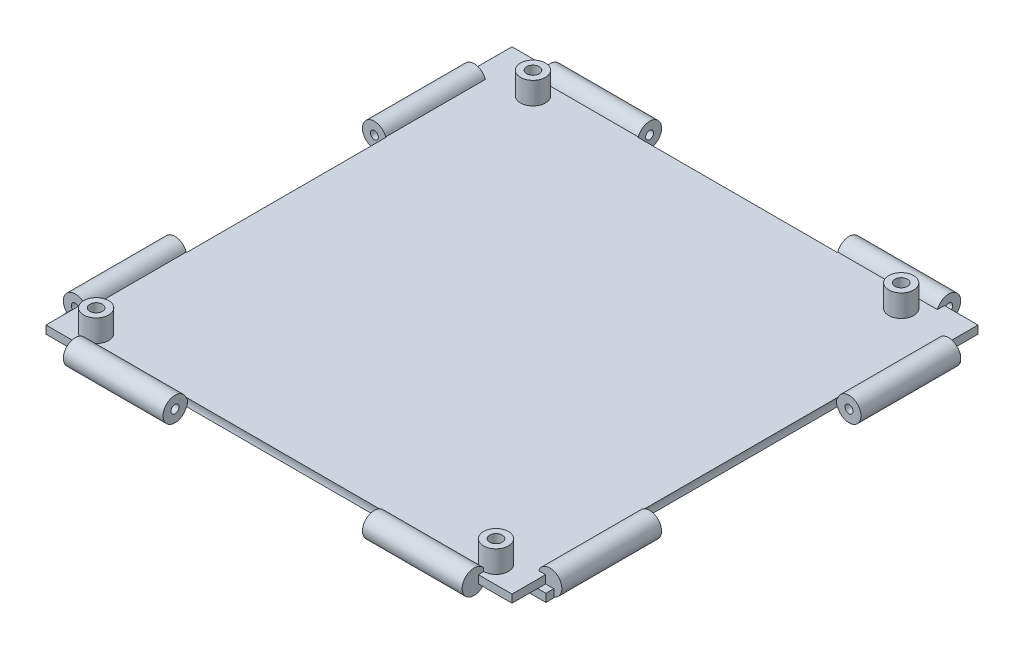
from build123d import *

# Parameters (mm, degrees)
SKETCH3_W                 = 97
SKETCH3_H                 = 97
BOSS_EXTRUDE2_DEPTH       = 1.6
SKETCH6_R                 = 2.4
BOSS_EXTRUDE3_DEPTH       = 25
SKETCH8_R                 = 2.4
BOSS_EXTRUDE4_DEPTH       = 25
BOSS_EXTRUDE5_START       = -25
SKETCH10_R                = 2.4
BOSS_EXTRUDE5_DEPTH       = 25
BOSS_EXTRUDE6_START       = -25
SKETCH11_R                = 2.4
BOSS_EXTRUDE6_DEPTH       = 25
SKETCH12_R                = 2.4
BOSS_EXTRUDE7_DEPTH       = 25
SKETCH13_R                = 2.4
BOSS_EXTRUDE8_DEPTH       = 25
BOSS_EXTRUDE9_START       = -25
SKETCH15_R                = 2.4
BOSS_EXTRUDE9_DEPTH       = 25
BOSS_EXTRUDE10_START      = -25
SKETCH16_R                = 2.4
BOSS_EXTRUDE10_DEPTH      = 25
SKETCH24_W                = 4.8
SKETCH24_H                = 5.548100674
CUT_EXTRUDE6_DEPTH        = 3.3
SKETCH25_W                = 4.8
SKETCH25_H                = 4.8
CUT_EXTRUDE7_DEPTH        = 3.3
SKETCH27_W                = 4.8
SKETCH27_H                = 5.15761508
CUT_EXTRUDE8_DEPTH        = 3.3
SKETCH28_W                = 4.8
SKETCH28_H                = 4.8
CUT_EXTRUDE9_DEPTH        = 6
SKETCH29_W                = 4.8
SKETCH29_H                = 5.426654508
CUT_EXTRUDE10_DEPTH       = 3.3
SKETCH30_W                = 5.09884484
SKETCH30_H                = 4.8
CUT_EXTRUDE11_DEPTH       = 3.3
SKETCH31_W                = 4.8
SKETCH31_H                = 5.480877926
CUT_EXTRUDE12_DEPTH       = 3.3
SKETCH32_W                = 4.987524697
SKETCH32_H                = 4.8
CUT_EXTRUDE13_DEPTH       = 3.3
BOSS_EXTRUDE11_START      = 1
SKETCH38_R                = 2.4
BOSS_EXTRUDE11_DEPTH      = 1
SKETCH39_R                = 2.4
BOSS_EXTRUDE12_DEPTH      = 1
BOSS_EXTRUDE13_START      = 1
SKETCH42_R                = 2.4
BOSS_EXTRUDE13_DEPTH      = 1
SKETCH43_R                = 2.4
BOSS_EXTRUDE14_DEPTH      = 1
BOSS_EXTRUDE15_START      = 1
SKETCH44_R                = 2.4
BOSS_EXTRUDE15_DEPTH      = 1
SKETCH45_R                = 2.4
BOSS_EXTRUDE16_DEPTH      = 1
BOSS_EXTRUDE17_START      = 1
SKETCH46_R                = 2.4
BOSS_EXTRUDE17_DEPTH      = 1
SKETCH47_R                = 2.4
BOSS_EXTRUDE18_DEPTH      = 1
CUT_EXTRUDE24_DEPTH       = 5.2
CUT_EXTRUDE25_DEPTH       = 5.2
CUT_EXTRUDE26_DEPTH       = 5.2
CUT_EXTRUDE27_DEPTH       = 5.2
CUT_EXTRUDE29_DEPTH       = 5.2
CUT_EXTRUDE30_DEPTH       = 5.2
CUT_EXTRUDE31_DEPTH       = 5.2
CUT_EXTRUDE32_DEPTH       = 5.2
SKETCH81_W                = 1.5372583
SKETCH81_H                = 1.5372583
BOSS_EXTRUDE21_DEPTH      = 1.6
SKETCH82_W                = 1.5372583
SKETCH82_H                = 1.5372583
BOSS_EXTRUDE22_DEPTH      = 1.6
SKETCH83_W                = 1.5372583
SKETCH83_H                = 1.5372583
BOSS_EXTRUDE23_DEPTH      = 1.6
SKETCH84_W                = 1.5372583
SKETCH84_H                = 1.5372583
BOSS_EXTRUDE24_DEPTH      = 1.6
SKETCH87_R                = 2.4
BOSS_EXTRUDE25_DEPTH      = 2.5
BOSS_EXTRUDE26_START      = 2.5
SKETCH88_R                = 2.4
BOSS_EXTRUDE26_DEPTH      = 2.5
SKETCH91_R                = 2.5
CUT_EXTRUDE33_DEPTH       = 40
BOSS_EXTRUDE27_START      = 2.5
SKETCH93_R                = 2.4
BOSS_EXTRUDE27_DEPTH      = 2.5
SKETCH94_R                = 2.4
BOSS_EXTRUDE28_DEPTH      = 2.5
SKETCH97_R                = 2.5
CUT_EXTRUDE34_DEPTH       = 40
BOSS_EXTRUDE29_START      = 2.5
SKETCH98_R                = 2.4
BOSS_EXTRUDE29_DEPTH      = 2.5
SKETCH99_R                = 2.4
BOSS_EXTRUDE30_DEPTH      = 2.5
SKETCH100_R               = 2.5
CUT_EXTRUDE35_DEPTH       = 40
SKETCH101_R               = 2.4
BOSS_EXTRUDE31_DEPTH      = 2.5
BOSS_EXTRUDE32_START      = 2.5
SKETCH102_R               = 2.4
BOSS_EXTRUDE32_DEPTH      = 2.5
SKETCH104_R               = 2.5
CUT_EXTRUDE36_DEPTH       = 40
SKETCH105_R               = 0.81
CUT_EXTRUDE37_DEPTH       = 78.5
SKETCH106_R               = 0.81
CUT_EXTRUDE38_DEPTH       = 78.5
SKETCH107_R               = 0.81
CUT_EXTRUDE39_DEPTH       = 78.5
SKETCH108_R               = 0.81
CUT_EXTRUDE40_DEPTH       = 78.5
CUT_EXTRUDE47_DEPTH       = 20
CUT_EXTRUDE48_DEPTH       = 20
CUT_EXTRUDE49_DEPTH       = 20
CUT_EXTRUDE50_DEPTH       = 20
SKETCH139_R               = 15
BOSS_EXTRUDE40_DEPTH      = 1.6
SKETCH140_R               = 5
CUT_EXTRUDE51_DEPTH       = 1.6
FILLET7_R                 = 2
CUT_EXTRUDE41_DEPTH       = 1.6
CUT_EXTRUDE42_DEPTH       = 1.6
CUT_EXTRUDE43_DEPTH       = 1.6
CUT_EXTRUDE44_DEPTH       = 1.6
SKETCH123_R               = 15
BOSS_EXTRUDE35_DEPTH      = 1.6
SKETCH124_R               = 5
CUT_EXTRUDE45_DEPTH       = 1.6
FILLET4_R                 = 2
SKETCH144_W               = 6.7372583
SKETCH144_H               = 1.6
BOSS_EXTRUDE42_DEPTH      = 1.6
SKETCH145_W               = 8.3372583
SKETCH145_H               = 1.6
BOSS_EXTRUDE43_DEPTH      = 1.6
SKETCH147_W               = 8.4
SKETCH147_H               = 1.6
BOSS_EXTRUDE44_DEPTH      = 1.6
SKETCH149_W               = 8.4
SKETCH149_H               = 1.6
BOSS_EXTRUDE45_DEPTH      = 1.6
SKETCH150_W               = 8.4
SKETCH150_H               = 1.6
BOSS_EXTRUDE46_DEPTH      = 1.6
SKETCH151_W               = 8.4
SKETCH151_H               = 1.6
BOSS_EXTRUDE47_DEPTH      = 1.6
FILLET12_R                = 1
SKETCH162_R               = 2.5
BOSS_EXTRUDE53_DEPTH      = 4.45
SKETCH163_R               = 2.5
BOSS_EXTRUDE54_DEPTH      = 4.45
SKETCH164_R               = 2.5
BOSS_EXTRUDE55_DEPTH      = 4.45
SKETCH172_R               = 2.5
BOSS_EXTRUDE57_DEPTH      = 4.45
M3X0_5_TAPPED_HOLE2_D     = 2.5
M3X0_5_TAPPED_HOLE2_DEPTH = 4.45
M3X0_5_TAPPED_HOLE2_TIP   = 0.751075774
SKETCH176_W               = 84.989213742
SKETCH176_H               = 89.710836726
BOSS_EXTRUDE58_DEPTH      = 1.6


with BuildPart() as part:
    # Sketch3 → Boss-Extrude2 (new body)
    with BuildSketch(Plane(origin=(0, 0, 0), x_dir=(1, 0, 0), z_dir=(0, 1, 0))):
        Rectangle(SKETCH3_W, SKETCH3_H)
    extrude(amount=BOSS_EXTRUDE2_DEPTH)

    # Sketch6 → Boss-Extrude3 (add)
    with BuildSketch(Plane.XY.offset(48.5)):
        with Locations((-47.6, 0.8)):
            Circle(SKETCH6_R)
    extrude(amount=-BOSS_EXTRUDE3_DEPTH)

    # Sketch8 → Boss-Extrude4 (add)
    with BuildSketch(Plane.XY.offset(48.5)):
        with Locations((47.6, 0.8)):
            Circle(SKETCH8_R)
    extrude(amount=-BOSS_EXTRUDE4_DEPTH)

    # Sketch10 → Boss-Extrude5 (add)
    with BuildSketch(Plane(origin=(0, 0, -48.5), x_dir=(-1, 0, 0), z_dir=(0, 0, -1)).offset(BOSS_EXTRUDE5_START)):
        with Locations((-47.6, 0.8)):
            Circle(SKETCH10_R)
    extrude(amount=BOSS_EXTRUDE5_DEPTH)

    # Sketch11 → Boss-Extrude6 (add)
    with BuildSketch(Plane(origin=(0, 0, -48.5), x_dir=(-1, 0, 0), z_dir=(0, 0, -1)).offset(BOSS_EXTRUDE6_START)):
        with Locations((47.6, 0.8)):
            Circle(SKETCH11_R)
    extrude(amount=BOSS_EXTRUDE6_DEPTH)

    # Sketch12 → Boss-Extrude7 (add)
    with BuildSketch(Plane.ZY.offset(48.5)):
        with Locations((-47.6, 0.8)):
            Circle(SKETCH12_R)
    extrude(amount=-BOSS_EXTRUDE7_DEPTH)

    # Sketch13 → Boss-Extrude8 (add)
    with BuildSketch(Plane.ZY.offset(48.5)):
        with Locations((47.6, 0.8)):
            Circle(SKETCH13_R)
    extrude(amount=-BOSS_EXTRUDE8_DEPTH)

    # Sketch15 → Boss-Extrude9 (add)
    with BuildSketch(Plane(origin=(48.5, 0, 0), x_dir=(0, 0, -1), z_dir=(1, 0, 0)).offset(BOSS_EXTRUDE9_START)):
        with Locations((-47.6, 0.8)):
            Circle(SKETCH15_R)
    extrude(amount=BOSS_EXTRUDE9_DEPTH)

    # Sketch16 → Boss-Extrude10 (add)
    with BuildSketch(Plane(origin=(48.5, 0, 0), x_dir=(0, 0, -1), z_dir=(1, 0, 0)).offset(BOSS_EXTRUDE10_START)):
        with Locations((47.6, 0.8)):
            Circle(SKETCH16_R)
    extrude(amount=BOSS_EXTRUDE10_DEPTH)

    # Sketch24 → Cut-Extrude6 (cut)
    with BuildSketch(Plane.XY.offset(48.5)):
        with Locations((-47.6, 0.8)):
            Rectangle(SKETCH24_W, SKETCH24_H)
    extrude(amount=-CUT_EXTRUDE6_DEPTH, mode=Mode.SUBTRACT)

    # Sketch25 → Cut-Extrude7 (cut)
    with BuildSketch(Plane(origin=(0, 0, 48.5), x_dir=(-1, 0, 0), z_dir=(0, 0, -1))):
        with Locations((47.6, 0.8)):
            Rectangle(SKETCH25_W, SKETCH25_H)
    extrude(amount=-CUT_EXTRUDE7_DEPTH, mode=Mode.SUBTRACT)

    # Sketch27 → Cut-Extrude8 (cut)
    with BuildSketch(Plane(origin=(0, 0, -48.5), x_dir=(-1, 0, 0), z_dir=(0, 0, -1))):
        with Locations((47.6, 0.8)):
            Rectangle(SKETCH27_W, SKETCH27_H)
    extrude(amount=-CUT_EXTRUDE8_DEPTH, mode=Mode.SUBTRACT)

    # Sketch28 → Cut-Extrude9 (cut)
    with BuildSketch(Plane(origin=(0, 0, -45.2), x_dir=(-1, 0, 0), z_dir=(0, 0, -1))):
        with Locations((47.6, 0.8)):
            Rectangle(SKETCH28_W, SKETCH28_H)
    extrude(amount=CUT_EXTRUDE9_DEPTH, mode=Mode.SUBTRACT)

    # Sketch29 → Cut-Extrude10 (cut)
    with BuildSketch(Plane.XY.offset(48.5)):
        with Locations((47.6, 0.8)):
            Rectangle(SKETCH29_W, SKETCH29_H)
    extrude(amount=-CUT_EXTRUDE10_DEPTH, mode=Mode.SUBTRACT)

    # Sketch30 → Cut-Extrude11 (cut)
    with BuildSketch(Plane(origin=(0, 0, 48.5), x_dir=(-1, 0, 0), z_dir=(0, 0, -1))):
        with Locations((-47.74942242, 0.8)):
            Rectangle(SKETCH30_W, SKETCH30_H)
    extrude(amount=-CUT_EXTRUDE11_DEPTH, mode=Mode.SUBTRACT)

    # Sketch31 → Cut-Extrude12 (cut)
    with BuildSketch(Plane(origin=(0, 0, -48.5), x_dir=(-1, 0, 0), z_dir=(0, 0, -1))):
        with Locations((-47.6, 0.8)):
            Rectangle(SKETCH31_W, SKETCH31_H)
    extrude(amount=-CUT_EXTRUDE12_DEPTH, mode=Mode.SUBTRACT)

    # Sketch32 → Cut-Extrude13 (cut)
    with BuildSketch(Plane.XY.offset(-48.5)):
        with Locations((47.693762349, 0.8)):
            Rectangle(SKETCH32_W, SKETCH32_H)
    extrude(amount=-CUT_EXTRUDE13_DEPTH, mode=Mode.SUBTRACT)

    # Sketch38 → Boss-Extrude11 (add)
    with BuildSketch(Plane.XY.offset(-23.5).offset(BOSS_EXTRUDE11_START)):
        with Locations((-47.6, 0.8)):
            Circle(SKETCH38_R)
    extrude(amount=-BOSS_EXTRUDE11_DEPTH)

    # Sketch39 → Boss-Extrude12 (add)
    with BuildSketch(Plane(origin=(0, 0, 23.5), x_dir=(-1, 0, 0), z_dir=(0, 0, -1))):
        with Locations((47.6, 0.8)):
            Circle(SKETCH39_R)
    extrude(amount=BOSS_EXTRUDE12_DEPTH)

    # Sketch42 → Boss-Extrude13 (add)
    with BuildSketch(Plane.XY.offset(-23.5).offset(BOSS_EXTRUDE13_START)):
        with Locations((47.6, 0.8)):
            Circle(SKETCH42_R)
    extrude(amount=-BOSS_EXTRUDE13_DEPTH)

    # Sketch43 → Boss-Extrude14 (add)
    with BuildSketch(Plane(origin=(0, 0, 23.5), x_dir=(-1, 0, 0), z_dir=(0, 0, -1))):
        with Locations((-47.6, 0.8)):
            Circle(SKETCH43_R)
    extrude(amount=BOSS_EXTRUDE14_DEPTH)

    # Sketch44 → Boss-Extrude15 (add)
    with BuildSketch(Plane.ZY.offset(-23.5).offset(BOSS_EXTRUDE15_START)):
        with Locations((-47.6, 0.8)):
            Circle(SKETCH44_R)
    extrude(amount=-BOSS_EXTRUDE15_DEPTH)

    # Sketch45 → Boss-Extrude16 (add)
    with BuildSketch(Plane(origin=(-23.5, 0, 0), x_dir=(0, 0, -1), z_dir=(1, 0, 0))):
        with Locations((47.6, 0.8)):
            Circle(SKETCH45_R)
    extrude(amount=BOSS_EXTRUDE16_DEPTH)

    # Sketch46 → Boss-Extrude17 (add)
    with BuildSketch(Plane.ZY.offset(-23.5).offset(BOSS_EXTRUDE17_START)):
        with Locations((47.6, 0.8)):
            Circle(SKETCH46_R)
    extrude(amount=-BOSS_EXTRUDE17_DEPTH)

    # Sketch47 → Boss-Extrude18 (add)
    with BuildSketch(Plane(origin=(-23.5, 0, 0), x_dir=(0, 0, -1), z_dir=(1, 0, 0))):
        with Locations((-47.6, 0.8)):
            Circle(SKETCH47_R)
    extrude(amount=BOSS_EXTRUDE18_DEPTH)

    # Sketch69 → Cut-Extrude24 (cut)
    with BuildSketch(Plane.XY.offset(45.2)):
        Polygon((-45.3372583, 1.6), (-46.7372583, 1.6), (-46.7372583, 0), (-45.3372583, 0), (-45.3372583, -2.296346165), (-50.861781819, -2.296346165), (-50.861781819, 4.089099576), (-45.3372583, 4.089099576), align=None)
    extrude(amount=-CUT_EXTRUDE24_DEPTH, mode=Mode.SUBTRACT)

    # Sketch72 → Cut-Extrude25 (cut)
    with BuildSketch(Plane.XY.offset(45.2)):
        Polygon((45.3372583, 1.6), (46.7372583, 1.6), (46.7372583, 0), (45.3372583, 0), (45.3372583, -2.331961344), (51.56640404, -2.331961344), (51.56640404, 3.886760814), (45.3372583, 3.886760814), align=None)
    extrude(amount=-CUT_EXTRUDE25_DEPTH, mode=Mode.SUBTRACT)

    # Sketch74 → Cut-Extrude26 (cut)
    with BuildSketch(Plane(origin=(0, 0, -45.2), x_dir=(-1, 0, 0), z_dir=(0, 0, -1))):
        Polygon((-45.3372583, 1.6), (-46.7372583, 1.6), (-46.7372583, 0), (-45.3372583, 0), (-45.3372583, -2.152541816), (-50.402223677, -2.152541816), (-50.402223677, 3.951890312), (-45.3372583, 3.951890312), align=None)
    extrude(amount=-CUT_EXTRUDE26_DEPTH, mode=Mode.SUBTRACT)

    # Sketch75 → Cut-Extrude27 (cut)
    with BuildSketch(Plane(origin=(0, 0, -45.2), x_dir=(-1, 0, 0), z_dir=(0, 0, -1))):
        Polygon((45.3372583, 1.6), (46.7372583, 1.6), (46.7372583, 0), (45.3372583, 0), (45.3372583, -1.886407627), (51.292007853, -1.886407627), (51.292007853, 3.823835951), (45.3372583, 3.823835951), align=None)
    extrude(amount=-CUT_EXTRUDE27_DEPTH, mode=Mode.SUBTRACT)

    # Sketch77 → Cut-Extrude29 (cut)
    with BuildSketch(Plane.ZY.offset(45.2)):
        Polygon((-45.3372583, 1.6), (-45.3372583, 4.072789502), (-50.753871923, 4.072789502), (-50.753871923, -2.073669683), (-45.3372583, -2.073669683), (-45.3372583, 0), (-46.7372583, 0), (-46.7372583, 1.6), align=None)
    extrude(amount=-CUT_EXTRUDE29_DEPTH, mode=Mode.SUBTRACT)

    # Sketch78 → Cut-Extrude30 (cut)
    with BuildSketch(Plane.ZY.offset(45.2)):
        Polygon((45.3372583, 1.6), (45.3372583, 3.551844718), (50.698124542, 3.551844718), (50.698124542, -1.797720923), (45.3372583, -1.797720923), (45.3372583, 0), (46.7372583, 0), (46.7372583, 1.6), align=None)
    extrude(amount=-CUT_EXTRUDE30_DEPTH, mode=Mode.SUBTRACT)

    # Sketch79 → Cut-Extrude31 (cut)
    with BuildSketch(Plane(origin=(45.2, 0, 0), x_dir=(0, 0, -1), z_dir=(1, 0, 0))):
        Polygon((-45.3372583, 1.6), (-45.3372583, 4.000281976), (-50.784286874, 4.000281976), (-50.784286874, -1.851902168), (-45.3372583, -1.851902168), (-45.3372583, 0), (-46.7372583, 0), (-46.7372583, 1.6), align=None)
    extrude(amount=-CUT_EXTRUDE31_DEPTH, mode=Mode.SUBTRACT)

    # Sketch80 → Cut-Extrude32 (cut)
    with BuildSketch(Plane(origin=(45.2, 0, 0), x_dir=(0, 0, -1), z_dir=(1, 0, 0))):
        Polygon((45.3372583, 1.6), (45.3372583, 3.793833644), (50.51960102, 3.793833644), (50.51960102, -2.045122916), (45.3372583, -2.045122916), (45.3372583, 0), (46.7372583, 0), (46.7372583, 1.6), align=None)
    extrude(amount=-CUT_EXTRUDE32_DEPTH, mode=Mode.SUBTRACT)

    # Sketch81 → Boss-Extrude21 (add)
    with BuildSketch(Plane(origin=(0, 1.6, 0), x_dir=(1, 0, 0), z_dir=(0, 1, 0))):
        with Locations((-45.96862915, 45.96862915)):
            Rectangle(SKETCH81_W, SKETCH81_H)
    extrude(amount=-BOSS_EXTRUDE21_DEPTH)

    # Sketch82 → Boss-Extrude22 (add)
    with BuildSketch(Plane(origin=(0, 1.6, 0), x_dir=(1, 0, 0), z_dir=(0, 1, 0))):
        with Locations((45.96862915, 45.96862915)):
            Rectangle(SKETCH82_W, SKETCH82_H)
    extrude(amount=-BOSS_EXTRUDE22_DEPTH)

    # Sketch83 → Boss-Extrude23 (add)
    with BuildSketch(Plane(origin=(0, 1.6, 0), x_dir=(1, 0, 0), z_dir=(0, 1, 0))):
        with Locations((-45.96862915, -45.96862915)):
            Rectangle(SKETCH83_W, SKETCH83_H)
    extrude(amount=-BOSS_EXTRUDE23_DEPTH)

    # Sketch84 → Boss-Extrude24 (add)
    with BuildSketch(Plane(origin=(0, 1.6, 0), x_dir=(1, 0, 0), z_dir=(0, 1, 0))):
        with Locations((45.96862915, -45.96862915)):
            Rectangle(SKETCH84_W, SKETCH84_H)
    extrude(amount=-BOSS_EXTRUDE24_DEPTH)

    # Sketch87 → Boss-Extrude25 (add)
    with BuildSketch(Plane(origin=(-22.5, 0, 0), x_dir=(0, 0, -1), z_dir=(1, 0, 0))):
        with Locations((-47.6, 0.8)):
            Circle(SKETCH87_R)
    extrude(amount=BOSS_EXTRUDE25_DEPTH)

    # Sketch88 → Boss-Extrude26 (add)
    with BuildSketch(Plane.ZY.offset(-22.5).offset(BOSS_EXTRUDE26_START)):
        with Locations((47.6, 0.8)):
            Circle(SKETCH88_R)
    extrude(amount=-BOSS_EXTRUDE26_DEPTH)

    # Sketch91 → Cut-Extrude33 (cut)
    with BuildSketch(Plane(origin=(-20, 0, 0), x_dir=(0, 0, -1), z_dir=(1, 0, 0))):
        with Locations((-47.6, 0.8)):
            Circle(SKETCH91_R)
    extrude(amount=CUT_EXTRUDE33_DEPTH, mode=Mode.SUBTRACT)

    # Sketch93 → Boss-Extrude27 (add)
    with BuildSketch(Plane.XY.offset(-22.5).offset(BOSS_EXTRUDE27_START)):
        with Locations((-47.6, 0.8)):
            Circle(SKETCH93_R)
    extrude(amount=-BOSS_EXTRUDE27_DEPTH)

    # Sketch94 → Boss-Extrude28 (add)
    with BuildSketch(Plane(origin=(0, 0, 22.5), x_dir=(-1, 0, 0), z_dir=(0, 0, -1))):
        with Locations((47.6, 0.8)):
            Circle(SKETCH94_R)
    extrude(amount=BOSS_EXTRUDE28_DEPTH)

    # Sketch97 → Cut-Extrude34 (cut)
    with BuildSketch(Plane.XY.offset(-20)):
        with Locations((-47.6, 0.8)):
            Circle(SKETCH97_R)
    extrude(amount=CUT_EXTRUDE34_DEPTH, mode=Mode.SUBTRACT)

    # Sketch98 → Boss-Extrude29 (add)
    with BuildSketch(Plane.XY.offset(-22.5).offset(BOSS_EXTRUDE29_START)):
        with Locations((47.6, 0.8)):
            Circle(SKETCH98_R)
    extrude(amount=-BOSS_EXTRUDE29_DEPTH)

    # Sketch99 → Boss-Extrude30 (add)
    with BuildSketch(Plane(origin=(0, 0, 22.5), x_dir=(-1, 0, 0), z_dir=(0, 0, -1))):
        with Locations((-47.6, 0.8)):
            Circle(SKETCH99_R)
    extrude(amount=BOSS_EXTRUDE30_DEPTH)

    # Sketch100 → Cut-Extrude35 (cut)
    with BuildSketch(Plane.XY.offset(-20)):
        with Locations((47.6, 0.8)):
            Circle(SKETCH100_R)
    extrude(amount=CUT_EXTRUDE35_DEPTH, mode=Mode.SUBTRACT)

    # Sketch101 → Boss-Extrude31 (add)
    with BuildSketch(Plane(origin=(-22.5, 0, 0), x_dir=(0, 0, -1), z_dir=(1, 0, 0))):
        with Locations((47.6, 0.8)):
            Circle(SKETCH101_R)
    extrude(amount=BOSS_EXTRUDE31_DEPTH)

    # Sketch102 → Boss-Extrude32 (add)
    with BuildSketch(Plane.ZY.offset(-22.5).offset(BOSS_EXTRUDE32_START)):
        with Locations((-47.6, 0.8)):
            Circle(SKETCH102_R)
    extrude(amount=-BOSS_EXTRUDE32_DEPTH)

    # Sketch104 → Cut-Extrude36 (cut)
    with BuildSketch(Plane(origin=(-20, 0, 0), x_dir=(0, 0, -1), z_dir=(1, 0, 0))):
        with Locations((47.6, 0.8)):
            Circle(SKETCH104_R)
    extrude(amount=CUT_EXTRUDE36_DEPTH, mode=Mode.SUBTRACT)

    # Sketch105 → Cut-Extrude37 (cut)
    with BuildSketch(Plane.XY.offset(40)):
        with Locations((-47.6, 0.8)):
            Circle(SKETCH105_R)
    extrude(amount=-CUT_EXTRUDE37_DEPTH, mode=Mode.SUBTRACT)

    # Sketch106 → Cut-Extrude38 (cut)
    with BuildSketch(Plane.ZY.offset(40)):
        with Locations((47.6, 0.8)):
            Circle(SKETCH106_R)
    extrude(amount=-CUT_EXTRUDE38_DEPTH, mode=Mode.SUBTRACT)

    # Sketch107 → Cut-Extrude39 (cut)
    with BuildSketch(Plane(origin=(40, 0, 0), x_dir=(0, 0, -1), z_dir=(1, 0, 0))):
        with Locations((47.6, 0.8)):
            Circle(SKETCH107_R)
    extrude(amount=-CUT_EXTRUDE39_DEPTH, mode=Mode.SUBTRACT)

    # Sketch108 → Cut-Extrude40 (cut)
    with BuildSketch(Plane(origin=(0, 0, -40), x_dir=(-1, 0, 0), z_dir=(0, 0, -1))):
        with Locations((-47.6, 0.8)):
            Circle(SKETCH108_R)
    extrude(amount=-CUT_EXTRUDE40_DEPTH, mode=Mode.SUBTRACT)

    # Sketch135 → Cut-Extrude47 (cut)
    with BuildSketch(Plane(origin=(0, 1.6, 0), x_dir=(1, 0, 0), z_dir=(0, 1, 0))):
        Polygon((28.160388332, 35.231456144), (0, 7.071067812), (-28.160388332, 35.231456144), align=None)
    extrude(amount=-CUT_EXTRUDE47_DEPTH, mode=Mode.SUBTRACT)

    # Sketch136 → Cut-Extrude48 (cut)
    with BuildSketch(Plane(origin=(0, 1.6, 0), x_dir=(1, 0, 0), z_dir=(0, 1, 0))):
        Polygon((-28.160388332, -35.231456144), (0, -7.071067812), (28.160388332, -35.231456144), align=None)
    extrude(amount=-CUT_EXTRUDE48_DEPTH, mode=Mode.SUBTRACT)

    # Sketch137 → Cut-Extrude49 (cut)
    with BuildSketch(Plane(origin=(0, 1.6, 0), x_dir=(1, 0, 0), z_dir=(0, 1, 0))):
        Polygon((35.231456144, 28.160388332), (7.071067812, 0), (35.231456144, -28.160388332), align=None)
    extrude(amount=-CUT_EXTRUDE49_DEPTH, mode=Mode.SUBTRACT)

    # Sketch138 → Cut-Extrude50 (cut)
    with BuildSketch(Plane(origin=(0, 1.6, 0), x_dir=(1, 0, 0), z_dir=(0, 1, 0))):
        Polygon((-35.231456144, 28.160388332), (-7.071067812, 0), (-35.231456144, -28.160388332), align=None)
    extrude(amount=-CUT_EXTRUDE50_DEPTH, mode=Mode.SUBTRACT)

    # Sketch139 → Boss-Extrude40 (add)
    with BuildSketch(Plane(origin=(0, 1.6, 0), x_dir=(1, 0, 0), z_dir=(0, 1, 0))):
        Circle(SKETCH139_R)
    extrude(amount=-BOSS_EXTRUDE40_DEPTH)

    # Sketch140 → Cut-Extrude51 (cut)
    with BuildSketch(Plane(origin=(0, 1.6, 0), x_dir=(1, 0, 0), z_dir=(0, 1, 0))):
        with Locations(Location((0, 0, 0), (0, 0, 270))):
            Circle(SKETCH140_R)
    extrude(amount=-CUT_EXTRUDE51_DEPTH, mode=Mode.SUBTRACT)

    # Fillet7
    fillet7_edges = [part.edges().sort_by_distance(p)[0] for p in [
        (-13.535533906, 0.8, 6.464466094),
        (6.464466094, 0.8, -13.535533906),
        (13.535533906, 0.8, -6.464466094),
        (-6.464466094, 0.8, 13.535533906),
        (6.464466094, 0.8, 13.535533906),
        (13.535533906, 0.8, 6.464466094),
        (-6.464466094, 0.8, -13.535533906),
        (-13.535533906, 0.8, -6.464466094),
        (-28.160388332, 0.8, -35.231456144),
        (28.160388332, 0.8, -35.231456144),
        (28.160388332, 0.8, 35.231456144),
        (-28.160388332, 0.8, 35.231456144),
        (35.231456144, 0.8, -28.160388332),
        (35.231456144, 0.8, 28.160388332),
        (-35.231456144, 0.8, 28.160388332),
        (-35.231456144, 0.8, -28.160388332),
    ]]
    fillet(fillet7_edges, radius=FILLET7_R)

    # Sketch119 → Cut-Extrude41 (cut)
    with BuildSketch(Plane(origin=(0, 1.6, 0), x_dir=(1, 0, 0), z_dir=(0, 1, 0))):
        Polygon((-28.160388332, 35.231456144), (28.160388332, 35.231456144), (0, 7.071067812), align=None)
    extrude(amount=-CUT_EXTRUDE41_DEPTH, mode=Mode.SUBTRACT)

    # Sketch120 → Cut-Extrude42 (cut)
    with BuildSketch(Plane(origin=(0, 1.6, 0), x_dir=(1, 0, 0), z_dir=(0, 1, 0))):
        Polygon((-28.160388332, -35.231456144), (28.160388332, -35.231456144), (0, -7.071067812), align=None)
    extrude(amount=-CUT_EXTRUDE42_DEPTH, mode=Mode.SUBTRACT)

    # Sketch121 → Cut-Extrude43 (cut)
    with BuildSketch(Plane(origin=(0, 1.6, 0), x_dir=(1, 0, 0), z_dir=(0, 1, 0))):
        Polygon((-35.231456144, 28.160388332), (-35.231456144, -28.160388332), (-7.071067812, 0), align=None)
    extrude(amount=-CUT_EXTRUDE43_DEPTH, mode=Mode.SUBTRACT)

    # Sketch122 → Cut-Extrude44 (cut)
    with BuildSketch(Plane(origin=(0, 1.6, 0), x_dir=(1, 0, 0), z_dir=(0, 1, 0))):
        Polygon((35.231456144, 28.160388332), (35.231456144, -28.160388332), (7.071067812, 0), align=None)
    extrude(amount=-CUT_EXTRUDE44_DEPTH, mode=Mode.SUBTRACT)

    # Sketch123 → Boss-Extrude35 (add)
    with BuildSketch(Plane(origin=(0, 1.6, 0), x_dir=(1, 0, 0), z_dir=(0, 1, 0))):
        Circle(SKETCH123_R)
    extrude(amount=-BOSS_EXTRUDE35_DEPTH)

    # Sketch124 → Cut-Extrude45 (cut)
    with BuildSketch(Plane(origin=(0, 1.6, 0), x_dir=(1, 0, 0), z_dir=(0, 1, 0))):
        with Locations(Location((0, 0, 0), (0, 0, 270))):
            Circle(SKETCH124_R)
    extrude(amount=-CUT_EXTRUDE45_DEPTH, mode=Mode.SUBTRACT)

    # Fillet4
    fillet4_edges = [part.edges().sort_by_distance(p)[0] for p in [
        (28.160388332, 0.8, -35.231456144),
        (-28.160388332, 0.8, -35.231456144),
        (-28.160388332, 0.8, 35.231456144),
        (28.160388332, 0.8, 35.231456144),
        (-35.231456144, 0.8, -28.160388332),
        (-35.231456144, 0.8, 28.160388332),
        (35.231456144, 0.8, 28.160388332),
        (35.231456144, 0.8, -28.160388332),
        (-13.535533906, 0.8, 6.464466094),
        (6.464466094, 0.8, -13.535533906),
        (13.535533906, 0.8, -6.464466094),
        (-6.464466094, 0.8, 13.535533906),
        (6.464466094, 0.8, 13.535533906),
        (13.535533906, 0.8, 6.464466094),
        (-6.464466094, 0.8, -13.535533906),
        (-13.535533906, 0.8, -6.464466094),
    ]]
    fillet(fillet4_edges, radius=FILLET4_R)

    # Sketch144 → Boss-Extrude42 (add)
    with BuildSketch(Plane(origin=(0, 0, -46.7372583), x_dir=(-1, 0, 0), z_dir=(0, 0, -1))):
        with Locations((43.36862915, 0.8)):
            Rectangle(SKETCH144_W, SKETCH144_H)
    extrude(amount=BOSS_EXTRUDE42_DEPTH)

    # Sketch145 → Boss-Extrude43 (add)
    with BuildSketch(Plane.ZY.offset(46.7372583)):
        with Locations((-44.16862915, 0.8)):
            Rectangle(SKETCH145_W, SKETCH145_H)
    extrude(amount=BOSS_EXTRUDE43_DEPTH)

    # Sketch147 → Boss-Extrude44 (add)
    with BuildSketch(Plane.XZ):
        with Locations((-44.2, -40.8)):
            Rectangle(SKETCH147_W, SKETCH147_H)
    extrude(amount=BOSS_EXTRUDE44_DEPTH)

    # Sketch149 → Boss-Extrude45 (add)
    with BuildSketch(Plane.XZ):
        with Locations((-44.2, 40.8)):
            Rectangle(SKETCH149_W, SKETCH149_H)
    extrude(amount=BOSS_EXTRUDE45_DEPTH)

    # Sketch150 → Boss-Extrude46 (add)
    with BuildSketch(Plane.XZ):
        with Locations((44.2, -40.8)):
            Rectangle(SKETCH150_W, SKETCH150_H)
    extrude(amount=BOSS_EXTRUDE46_DEPTH)

    # Sketch151 → Boss-Extrude47 (add)
    with BuildSketch(Plane.XZ):
        with Locations((44.2, 40.8)):
            Rectangle(SKETCH151_W, SKETCH151_H)
    extrude(amount=BOSS_EXTRUDE47_DEPTH)

    # Fillet12
    fillet12_edges = [part.edges().sort_by_distance(p)[0] for p in [
        (-40, -0.8, -40),
        (-40, -0.8, 40),
        (40, -0.8, -40),
        (40, -0.8, 40),
    ]]
    fillet(fillet12_edges, radius=FILLET12_R)

    # Sketch162 → Boss-Extrude53 (add)
    with BuildSketch(Plane(origin=(0, 1.6, 0), x_dir=(1, 0, 0), z_dir=(0, 1, 0))):
        with Locations(Location((36.15, 41.92, 0), (0, 0, 90))):
            Circle(SKETCH162_R)
    extrude(amount=BOSS_EXTRUDE53_DEPTH)

    # Sketch163 → Boss-Extrude54 (add)
    with BuildSketch(Plane(origin=(0, 1.6, 0), x_dir=(1, 0, 0), z_dir=(0, 1, 0))):
        with Locations(Location((-40.25, -43.17, 0), (0, 0, 299.899244709))):
            Circle(SKETCH163_R)
    extrude(amount=BOSS_EXTRUDE54_DEPTH)

    # Sketch164 → Boss-Extrude55 (add)
    with BuildSketch(Plane(origin=(0, 1.6, 0), x_dir=(1, 0, 0), z_dir=(0, 1, 0))):
        with Locations(Location((39.96, -43.17, 0), (0, 0, 240.100755291))):
            Circle(SKETCH164_R)
    extrude(amount=BOSS_EXTRUDE55_DEPTH)

    # Sketch172 → Boss-Extrude57 (add)
    with BuildSketch(Plane(origin=(0, 1.6, 0), x_dir=(1, 0, 0), z_dir=(0, 1, 0))):
        with Locations(Location((-37.71, 41.92, 0), (0, 0, 90))):
            Circle(SKETCH172_R)
    extrude(amount=BOSS_EXTRUDE57_DEPTH)

    # M3x0.5 Tapped Hole2
    with Locations(Plane(origin=(0, 6.05, 0), x_dir=(1, 0, 0), z_dir=(0, 1, 0))):
        with Locations((-37.71, 41.92), (36.15, 41.92), (39.96, -43.17), (-40.25, -43.17)):
            Hole(M3X0_5_TAPPED_HOLE2_D / 2, depth=M3X0_5_TAPPED_HOLE2_DEPTH)
            with Locations((0, 0, -(M3X0_5_TAPPED_HOLE2_DEPTH + M3X0_5_TAPPED_HOLE2_TIP / 2))):  # 118° drill point
                Cone(0, M3X0_5_TAPPED_HOLE2_D / 2, M3X0_5_TAPPED_HOLE2_TIP, mode=Mode.SUBTRACT)

    # Sketch176 → Boss-Extrude58 (add)
    with BuildSketch(Plane.XZ):
        Rectangle(SKETCH176_W, SKETCH176_H)
    extrude(amount=-BOSS_EXTRUDE58_DEPTH)


solid = part.part
